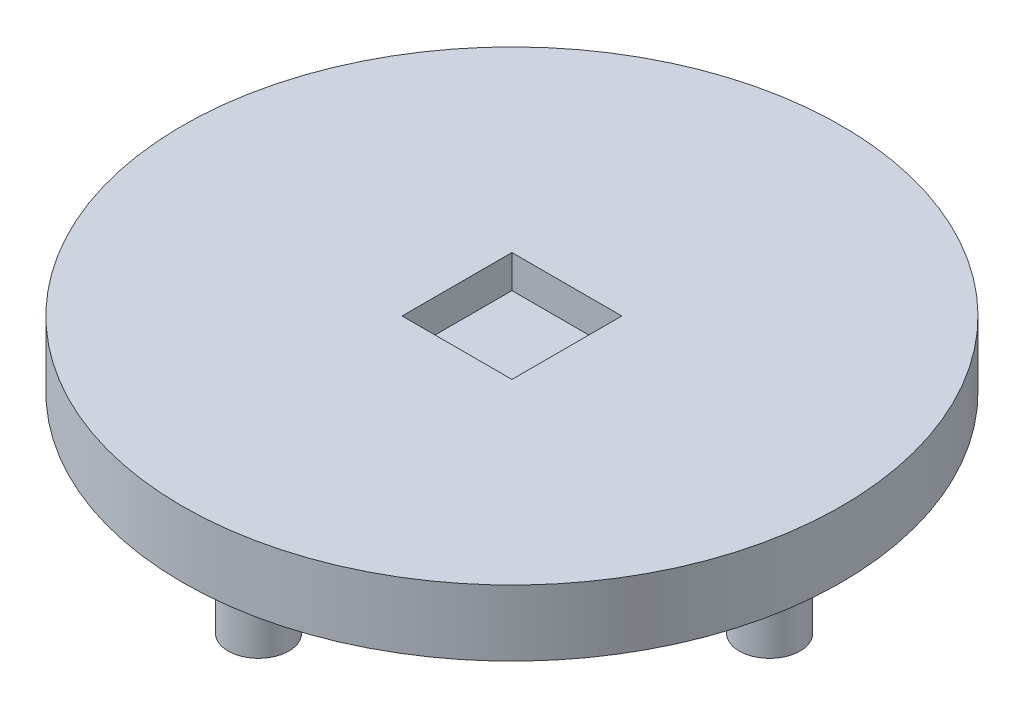
from build123d import *

# Parameters (mm, degrees)
SKETCH1_R           = 30
BOSS_EXTRUDE1_DEPTH = 6
SKETCH6_R           = 2.77
BOSS_EXTRUDE3_DEPTH = 7.5
CIRPATTERN3_COUNT   = 4
SKETCH11_W          = 10
SKETCH11_H          = 10
CUT_EXTRUDE3_DEPTH  = 3


with BuildPart() as part:
    # Sketch1 → Boss-Extrude1 (new body)
    with BuildSketch(Plane(origin=(0, 0, 0), x_dir=(1, 0, 0), z_dir=(0, 1, 0))):
        with Locations(Location((0, 0, 0), (0, 0, 270))):
            Circle(SKETCH1_R)
    extrude(amount=BOSS_EXTRUDE1_DEPTH)

    # Sketch6 → Boss-Extrude3 (add)
    with BuildSketch(Plane(origin=(0, 0, -4.132474232), x_dir=(1, 0, 0), z_dir=(0, -1, 0))):
        with Locations(Location((-0.002388639, 27.198186003, 0), (0, 0, 90))):
            Circle(SKETCH6_R)
        Polygon((2.047611361, 27.873186003), (2.047611361, 26.523186003), (0.672611361, 26.523186003), (0.672611361, 25.148186003), (-0.677388639, 25.148186003), (-0.677388639, 26.523186003), (-2.052388639, 26.523186003), (-2.052388639, 27.873186003), (-0.677388639, 27.873186003), (-0.677388639, 29.248186003), (0.672611361, 29.248186003), (0.672611361, 27.873186003), align=None, mode=Mode.SUBTRACT)
    boss_extrude3 = extrude(amount=BOSS_EXTRUDE3_DEPTH)

    # CirPattern3: Boss-Extrude3 ×4 about axis
    cirpattern3_axis = Axis((2.0539e-05, 0, -0.19833635), (0, 1, 0))
    for i in range(1, CIRPATTERN3_COUNT):
        add(boss_extrude3.rotate(cirpattern3_axis, i * 360 / CIRPATTERN3_COUNT))

    # Sketch11 → Cut-Extrude3 (cut)
    with BuildSketch(Plane(origin=(0, 6, 0), x_dir=(1, 0, 0), z_dir=(0, 1, 0))):
        Rectangle(SKETCH11_W, SKETCH11_H)
    extrude(amount=-CUT_EXTRUDE3_DEPTH, mode=Mode.SUBTRACT)


solid = part.part
